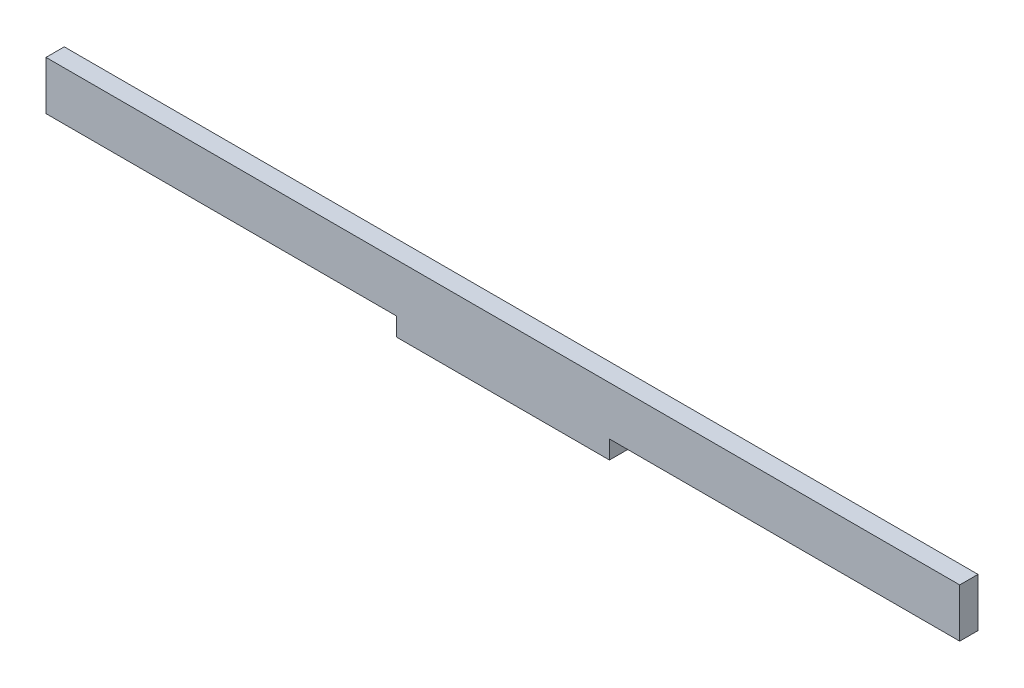
from build123d import *

# Parameters (mm, degrees)
EXTRUDE_1_DEPTH = 3


with BuildPart() as part:
    # Эскиз1 → Бобышка-Вытянуть1 (new body)
    with BuildSketch(Plane.XY):
        Polygon((-30.578677967, -5.308244507), (26.921322033, -5.308244507), (26.921322033, 2.691755493), (-123.078677967, 2.691755493), (-123.078677967, -5.308244507), (-65.578677967, -5.308244507), (-65.578677967, -8.308244507), (-30.578677967, -8.308244507), align=None)
    extrude(amount=EXTRUDE_1_DEPTH)


solid = part.part
